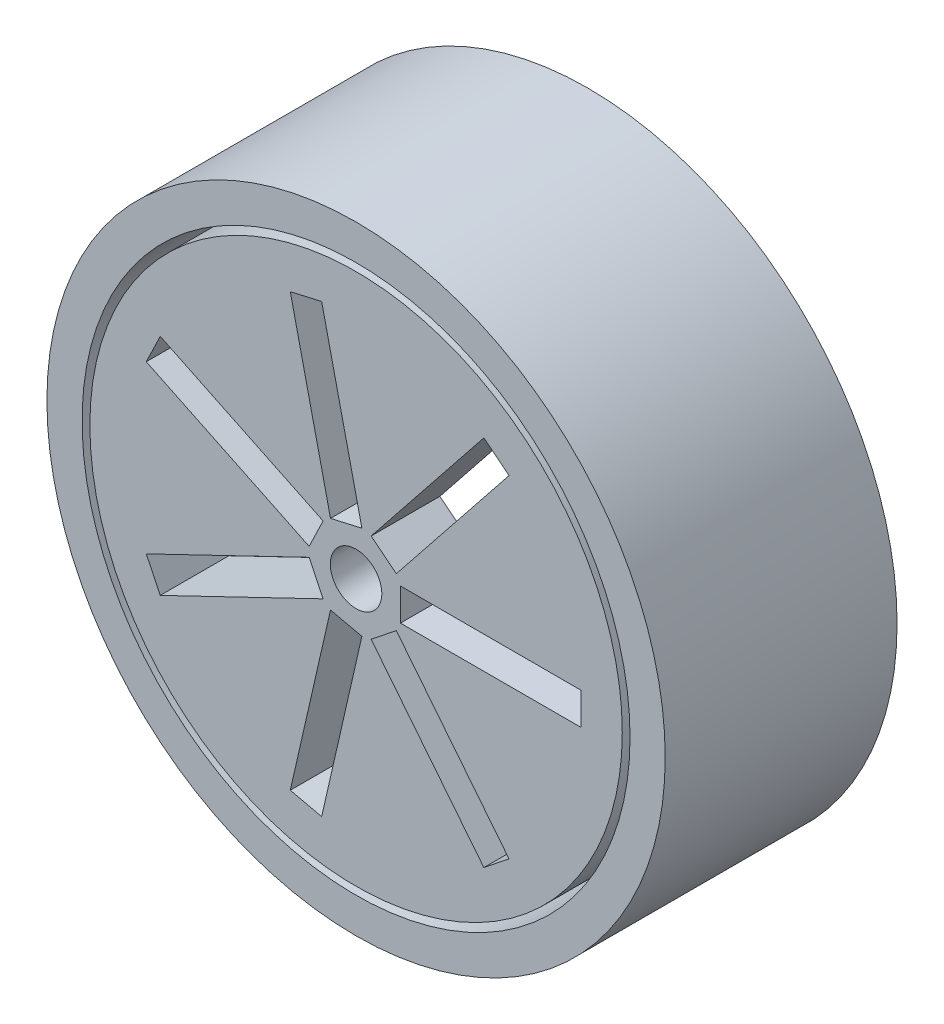
from build123d import *

# Parameters (mm, degrees)
ESQUISSE1_R             = 31
ESQUISSE1_W             = 21.049984125
ESQUISSE1_H             = 3.746915328
BOSS_EXTRU_1_DEPTH      = 27
ESQUISSE2_R             = 3
ENL_V_MAT_EXTRU_1_DEPTH = 27
ESQUISSE3_R             = 36
ESQUISSE3_R_2           = 31.904878758
BOSS_EXTRU_2_DEPTH      = 27
ENL_V_START             = -19
ESQUISSE4_R             = 26.281409308
ESQUISSE4_R_2           = 3
ENL_V_MAT_EXTRU_2_DEPTH = 19


with BuildPart() as part:
    # Esquisse1 → Boss.-Extru.1 (new body)
    with BuildSketch(Plane.XY):
        Circle(ESQUISSE1_R)
        with Locations((15.689557936, 0)):
            Rectangle(ESQUISSE1_W, ESQUISSE1_H, mode=Mode.SUBTRACT)
        Polygon((1.75532597, -5.20590194), (4.684782335, -2.869738445), (17.809232767, -19.32727874), (14.879776402, -21.663442235), align=None, mode=Mode.SUBTRACT)
        Polygon((-2.97571019, -4.618195874), (0.677262147, -5.451962973), (-4.00679998, -25.974180047), (-7.659772317, -25.140412949), align=None, mode=Mode.SUBTRACT)
        Polygon((-5.465975884, -0.552894122), (-3.840250251, -3.928748182), (-22.805630618, -13.061994003), (-24.431356251, -9.686139942), align=None, mode=Mode.SUBTRACT)
        Polygon((-3.840250251, 3.928748182), (-5.465975884, 0.552894122), (-24.431356251, 9.686139942), (-22.805630618, 13.061994003), align=None, mode=Mode.SUBTRACT)
        Polygon((0.677262147, 5.451962973), (-2.97571019, 4.618195874), (-7.659772317, 25.140412949), (-4.00679998, 25.974180047), align=None, mode=Mode.SUBTRACT)
        Polygon((4.684782335, 2.869738445), (1.75532597, 5.20590194), (14.879776402, 21.663442235), (17.809232767, 19.32727874), align=None, mode=Mode.SUBTRACT)
    extrude(amount=BOSS_EXTRU_1_DEPTH)

    # Esquisse2 → Enlèv. mat.-Extru.1 (cut)
    with BuildSketch(Plane.XY.offset(27)):
        Circle(ESQUISSE2_R)
    extrude(amount=-ENL_V_MAT_EXTRU_1_DEPTH, mode=Mode.SUBTRACT)

    # Esquisse4 → Enlèv. mat.-Extru.2 (cut)
    with BuildSketch(Plane(origin=(0, 0, 0), x_dir=(-1, 0, 0), z_dir=(0, 0, -1)).offset(ENL_V_START)):
        Circle(ESQUISSE4_R)
        with Locations(Location((0, 0, 0), (0, 0, 180))):
            Circle(ESQUISSE4_R_2, mode=Mode.SUBTRACT)
    extrude(amount=ENL_V_MAT_EXTRU_2_DEPTH, mode=Mode.SUBTRACT)


with BuildPart() as body_2:
    # Esquisse3 → Boss.-Extru.2 (new, through all)
    with BuildSketch(Plane.XY.offset(27)):
        Circle(ESQUISSE3_R)
        Circle(ESQUISSE3_R_2, mode=Mode.SUBTRACT)
    extrude(amount=-BOSS_EXTRU_2_DEPTH)


solid = Compound([part.part, body_2.part])
